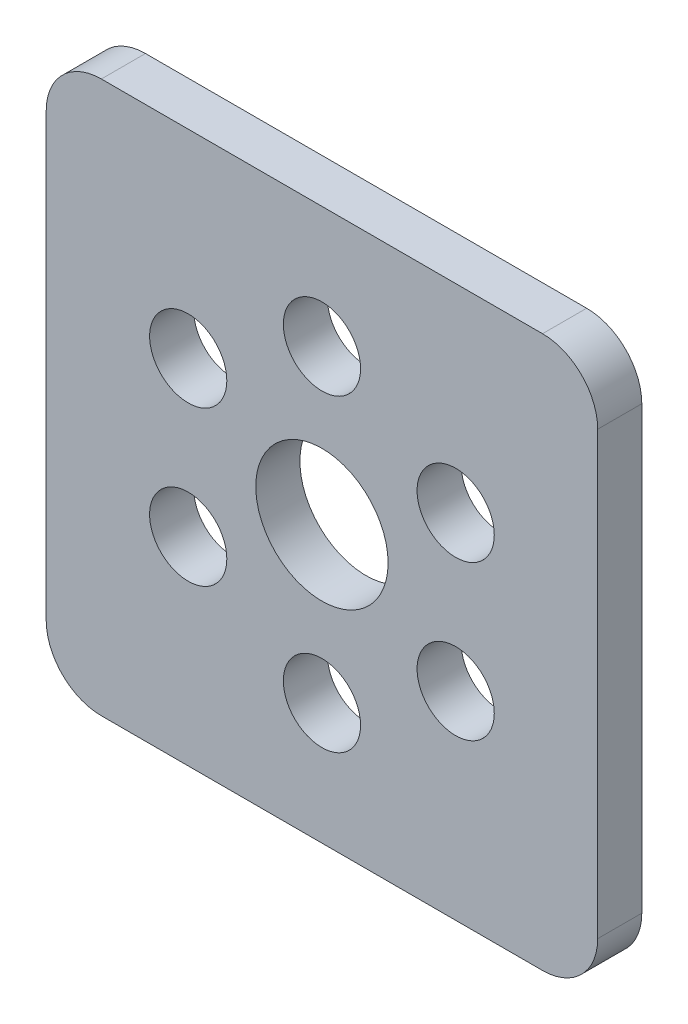
from build123d import *

# Parameters (mm, degrees)
SKETCH_1_W      = 50
SKETCH_1_H      = 50
SKETCH_1_R      = 3.5
SKETCH_1_R_2    = 6
EXTRUDE_1_DEPTH = 4
FILLET_1_R      = 5


with BuildPart() as part:
    # 草图1 → 凸台-拉伸1 (new body)
    with BuildSketch(Plane.XY):
        Rectangle(SKETCH_1_W, SKETCH_1_H)
        with Locations((0, 14)):
            Circle(SKETCH_1_R, mode=Mode.SUBTRACT)
        with Locations((12.124355653, 7)):
            Circle(SKETCH_1_R, mode=Mode.SUBTRACT)
        with Locations((12.124355653, -7)):
            Circle(SKETCH_1_R, mode=Mode.SUBTRACT)
        with Locations((0, -14)):
            Circle(SKETCH_1_R, mode=Mode.SUBTRACT)
        with Locations((-12.124355653, -7)):
            Circle(SKETCH_1_R, mode=Mode.SUBTRACT)
        with Locations((-12.124355653, 7)):
            Circle(SKETCH_1_R, mode=Mode.SUBTRACT)
        Circle(SKETCH_1_R_2, mode=Mode.SUBTRACT)
    extrude(amount=EXTRUDE_1_DEPTH)

    # 圆角1
    fillet_1_edges = [part.edges().sort_by_distance(p)[0] for p in [
        (-25, 25, 2),
        (25, 25, 2),
        (25, -25, 2),
        (-25, -25, 2),
    ]]
    fillet(fillet_1_edges, radius=FILLET_1_R)


solid = part.part
